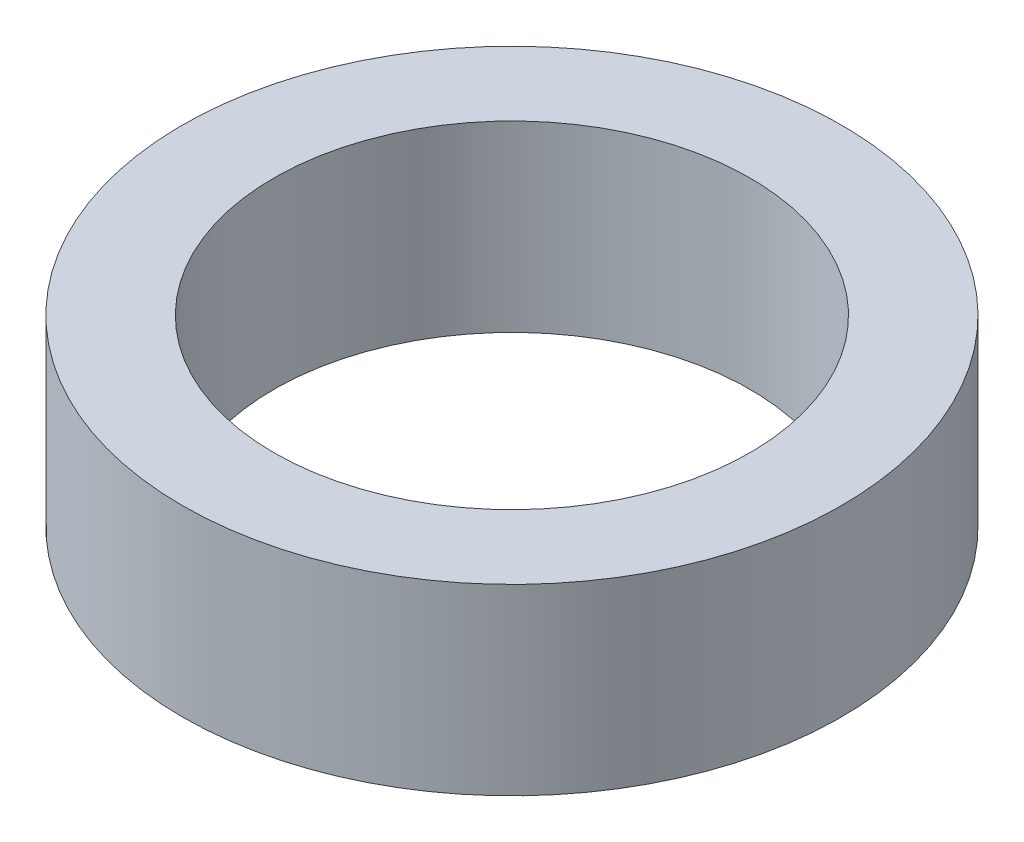
from build123d import *

# Parameters (mm, degrees)
SKETCH1_R           = 9
SKETCH1_R_2         = 6.5
BOSS_EXTRUDE1_DEPTH = 5


with BuildPart() as part:
    # Sketch1 → Boss-Extrude1 (new body)
    with BuildSketch(Plane(origin=(0, 0, 0), x_dir=(1, 0, 0), z_dir=(0, 1, 0))):
        with Locations(Location((0, 0, 0), (0, 0, 270))):
            Circle(SKETCH1_R)
        with Locations(Location((0, 0, 0), (0, 0, 270))):
            Circle(SKETCH1_R_2, mode=Mode.SUBTRACT)
    extrude(amount=BOSS_EXTRUDE1_DEPTH)


solid = part.part
